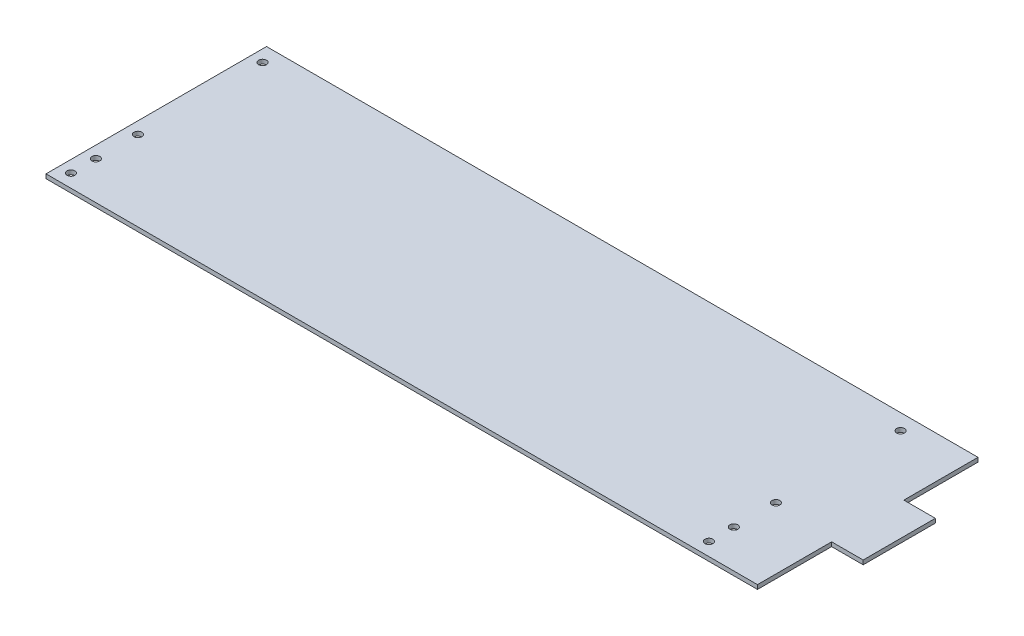
from build123d import *

# Parameters (mm, degrees)
SKETCH1_R           = 1.5
BOSS_EXTRUDE1_DEPTH = 1.6


with BuildPart() as part:
    # Sketch1 → Boss-Extrude1 (new body)
    with BuildSketch(Plane(origin=(0, 0, 0), x_dir=(1, 0, 0), z_dir=(0, 1, 0))):
        Polygon((271, 0), (271, 28.25), (283, 28.25), (283, 55.75), (271, 55.75), (271, 84), (0, 84), (0, 0), align=None)
        with Locations(Location((247.5, 30.5, 0), (0, 0, 270))):
            Circle(SKETCH1_R, mode=Mode.SUBTRACT)
        with Locations(Location((247.5, 78, 0), (0, 0, 270))):
            Circle(SKETCH1_R, mode=Mode.SUBTRACT)
        with Locations(Location((247.5, 5, 0), (0, 0, 270))):
            Circle(SKETCH1_R, mode=Mode.SUBTRACT)
        with Locations(Location((247.5, 14.5, 0), (0, 0, 270))):
            Circle(SKETCH1_R, mode=Mode.SUBTRACT)
        with Locations(Location((4.5, 78, 0), (0, 0, 270))):
            Circle(SKETCH1_R, mode=Mode.SUBTRACT)
        with Locations(Location((4.5, 5, 0), (0, 0, 270))):
            Circle(SKETCH1_R, mode=Mode.SUBTRACT)
        with Locations(Location((4.5, 14.5, 0), (0, 0, 270))):
            Circle(SKETCH1_R, mode=Mode.SUBTRACT)
        with Locations(Location((4.5, 30.5, 0), (0, 0, 270))):
            Circle(SKETCH1_R, mode=Mode.SUBTRACT)
    extrude(amount=BOSS_EXTRUDE1_DEPTH)


solid = part.part
